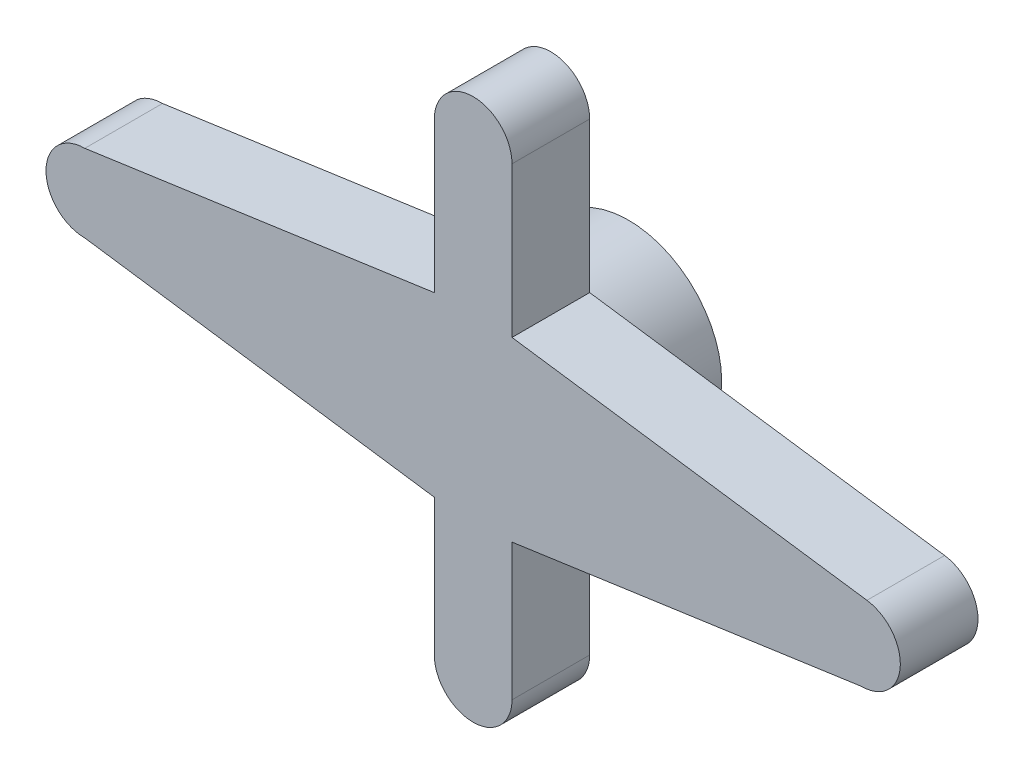
from build123d import *

# Parameters (mm, degrees)
SWEEP_THIN1_PROFILE_R   = 6
SWEEP_THIN1_PROFILE_R_2 = 5
BOSS_EXTRUDE1_DEPTH     = 5


with BuildPart() as part:
    # Sweep-Thin1: sweep along a path in Sketch1
    with BuildLine(Plane.YZ) as sweep_thin1_path:
        Line((0, 0), (0, 5))
    # Sweep-Thin1 profile (on start of the path) → Sweep-Thin1 (sweep)
    with BuildSketch(Plane.XY):
        Circle(SWEEP_THIN1_PROFILE_R)
        Circle(SWEEP_THIN1_PROFILE_R_2, mode=Mode.SUBTRACT)
    sweep(path=sweep_thin1_path.line)

    # Sketch3 → Boss-Extrude1 (add)
    with BuildSketch(Plane.XY.offset(5)):
        with BuildLine():
            Line((-25, 2.5), (-2.5, 5.703923584))
            Line((-2.5, 5.703923584), (-2.5, 15.384581875))
            ThreePointArc((-2.5, 15.384581875), (0, 17.884581875), (2.5, 15.384581875))
            Line((2.5, 15.384581875), (2.5, 5.705628852))
            Line((2.5, 5.705628852), (25.349939608, 2.475387297))
            ThreePointArc((25.349939608, 2.475387297), (27.493839233, -0.175402049), (25, -2.5))
            Line((25, -2.5), (2.5, -5.703923584))
            Line((2.5, -5.703923584), (2.5, -14.498631066))
            ThreePointArc((2.5, -14.498631066), (0, -16.998631066), (-2.5, -14.498631066))
            Line((-2.5, -14.498631066), (-2.5, -5.703923584))
            Line((-2.5, -5.703923584), (-25, -2.5))
            ThreePointArc((-25, -2.5), (-27.5, 0), (-25, 2.5))
        make_face()
    extrude(amount=BOSS_EXTRUDE1_DEPTH)


solid = part.part
